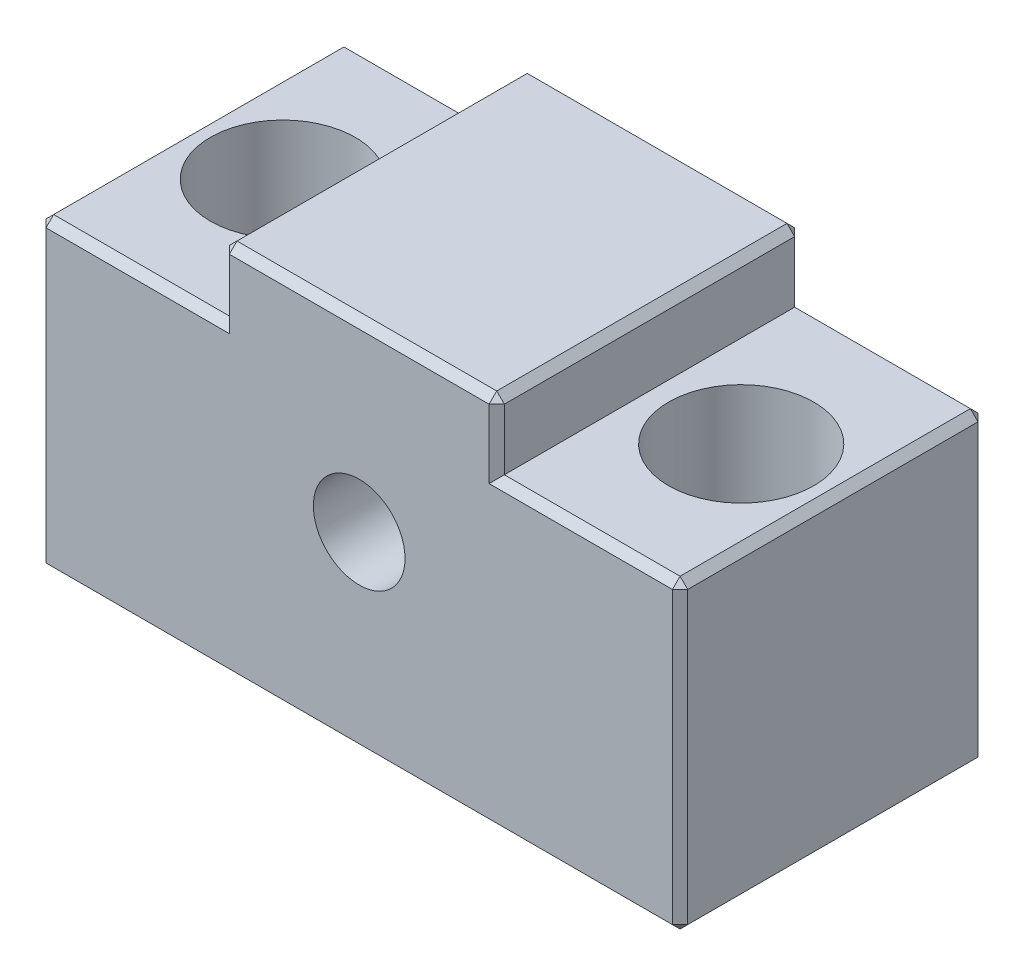
from build123d import *

# Parameters (mm, degrees)
BOSS_EXTRUDE1_DEPTH = 20
CUT_EXTRUDE2_REACH  = 39.964
SKETCH4_R           = 2.75
SKETCH2_R           = 4.75
CUT_EXTRUDE3_DEPTH  = 11.2
CUT_EXTRUDE4_REACH  = 39.964
SKETCH5_R           = 3
SKETCH6_R           = 5.5
CUT_EXTRUDE5_DEPTH  = 3.5
CHAMFER1_SIZE       = 0.5


with BuildPart() as part:
    # Sketch1 → Boss-Extrude1 (new body)
    with BuildSketch(Plane.XY):
        Polygon((-21, 0), (21, 0), (21, 20), (9, 20), (9, 24.5), (-9, 24.5), (-9, 20), (-21, 20), align=None)
    extrude(amount=-BOSS_EXTRUDE1_DEPTH)

    # Sketch4 → Cut-Extrude2 (cut, up to next)
    with BuildSketch(Plane(origin=(0, 0, 0), x_dir=(1, 0, 0), z_dir=(0, 1, 0)), mode=Mode.PRIVATE) as cut_extrude2_sk1:
        with Locations(Location((-15, 10, 0), (0, 0, 180))):
            Circle(SKETCH4_R)
    cut_extrude2_tool1 = extrude(cut_extrude2_sk1.sketch, amount=CUT_EXTRUDE2_REACH, mode=Mode.PRIVATE) & part.part
    cut_extrude2 = cut_extrude2_tool1.solids().sort_by_distance((-15, 0, -10))[0]
    add(cut_extrude2, mode=Mode.SUBTRACT)

    # Sketch2 → Cut-Extrude3 (cut)
    with BuildSketch(Plane(origin=(0, 20, 0), x_dir=(1, 0, 0), z_dir=(0, 1, 0))):
        with Locations(Location((-15, 10, 0), (0, 0, 270))):
            Circle(SKETCH2_R)
    cut_extrude3 = extrude(amount=-CUT_EXTRUDE3_DEPTH, mode=Mode.SUBTRACT)

    # Mirror1: Cut-Extrude2, Cut-Extrude3 across plane
    add(cut_extrude2.mirror(Plane(origin=(0, 0, 0), x_dir=(0, 0, 1), z_dir=(1, 0, 0))), mode=Mode.SUBTRACT)
    add(cut_extrude3.mirror(Plane(origin=(0, 0, 0), x_dir=(0, 0, 1), z_dir=(1, 0, 0))), mode=Mode.SUBTRACT)

    # Sketch5 → Cut-Extrude4 (cut, up to next)
    with BuildSketch(Plane.XY, mode=Mode.PRIVATE) as cut_extrude4_sk1:
        with Locations((0, 12.5)):
            Circle(SKETCH5_R)
    cut_extrude4_tool1 = extrude(cut_extrude4_sk1.sketch, amount=-CUT_EXTRUDE4_REACH, mode=Mode.PRIVATE) & part.part
    add(cut_extrude4_tool1.solids().sort_by_distance((0, 12.5, 0))[0], mode=Mode.SUBTRACT)

    # Sketch6 → Cut-Extrude5 (cut)
    with BuildSketch(Plane(origin=(0, 0, -20), x_dir=(-1, 0, 0), z_dir=(0, 0, -1))):
        with Locations((0, 12.5)):
            Circle(SKETCH6_R)
    extrude(amount=-CUT_EXTRUDE5_DEPTH, mode=Mode.SUBTRACT)

    # Chamfer1
    chamfer1_edges = [part.edges().sort_by_distance(p)[0] for p in [
        (0, 24.5, -20),
        (9, 22.25, 0),
        (15, 20, 0),
        (-9, 22.25, -20),
        (21, 20, -10),
        (21, 0, -10),
        (-21, 0, -10),
        (-21, 20, -10),
        (-9, 24.5, -10),
        (9, 24.5, -10),
        (-15, 20, -20),
        (-21, 10, -20),
        (0, 0, -20),
        (21, 10, -20),
        (15, 20, -20),
        (9, 22.25, -20),
        (21, 10, 0),
        (0, 0, 0),
        (-21, 10, 0),
        (-15, 20, 0),
        (-9, 22.25, 0),
        (0, 24.5, 0),
    ]]
    chamfer(chamfer1_edges, length=CHAMFER1_SIZE)


solid = part.part
